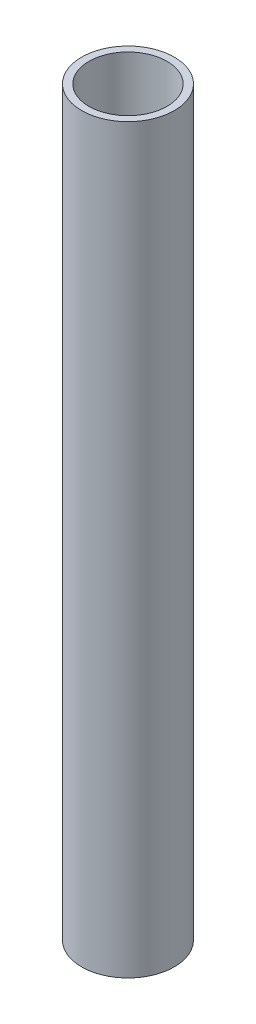
from build123d import *

# Parameters (mm, degrees)
SKETCH1_R           = 6.35
SKETCH1_R_2         = 5.35
BOSS_EXTRUDE1_DEPTH = 101.6


with BuildPart() as part:
    # Sketch1 → Boss-Extrude1 (new body)
    with BuildSketch(Plane(origin=(0, 0, 0), x_dir=(1, 0, 0), z_dir=(0, 1, 0))):
        with Locations(Location((0, 0, 0), (0, 0, 270))):
            Circle(SKETCH1_R)
        with Locations(Location((0, 0, 0), (0, 0, 270))):
            Circle(SKETCH1_R_2, mode=Mode.SUBTRACT)
    extrude(amount=BOSS_EXTRUDE1_DEPTH)


solid = part.part
